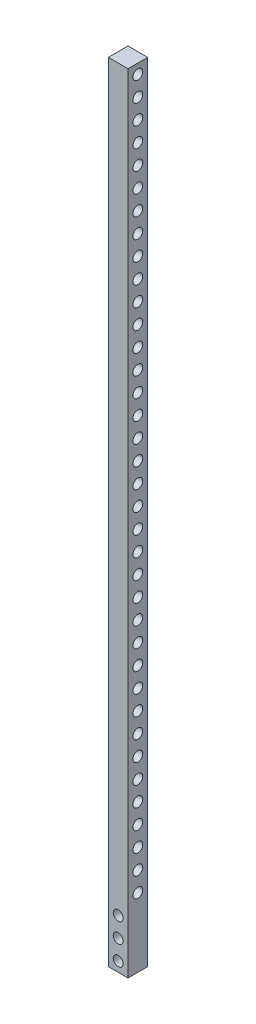
from build123d import *

# Parameters (mm, degrees)
ESQUISSE1_W             = 10
ESQUISSE1_H             = 400
ESQUISSE1_R             = 2.5
BASE_DEPTH              = 10
ESQUISSE2_R             = 2.5
ENL_V_MAT_EXTRU_1_DEPTH = 10


with BuildPart() as part:
    # Esquisse1 → BASE (new body)
    with BuildSketch(Plane(origin=(0, 0, 0), x_dir=(0, 0, -1), z_dir=(1, 0, 0))):
        Rectangle(ESQUISSE1_W, ESQUISSE1_H)
        with Locations((0, 195)):
            Circle(ESQUISSE1_R, mode=Mode.SUBTRACT)
        with Locations((0, 185)):
            Circle(ESQUISSE1_R, mode=Mode.SUBTRACT)
        with Locations((0, 175)):
            Circle(ESQUISSE1_R, mode=Mode.SUBTRACT)
        with Locations((0, 165)):
            Circle(ESQUISSE1_R, mode=Mode.SUBTRACT)
        with Locations((0, 155)):
            Circle(ESQUISSE1_R, mode=Mode.SUBTRACT)
        with Locations((0, 145)):
            Circle(ESQUISSE1_R, mode=Mode.SUBTRACT)
        with Locations((0, 135)):
            Circle(ESQUISSE1_R, mode=Mode.SUBTRACT)
        with Locations((0, 125)):
            Circle(ESQUISSE1_R, mode=Mode.SUBTRACT)
        with Locations((0, 115)):
            Circle(ESQUISSE1_R, mode=Mode.SUBTRACT)
        with Locations((0, 105)):
            Circle(ESQUISSE1_R, mode=Mode.SUBTRACT)
        with Locations((0, 95)):
            Circle(ESQUISSE1_R, mode=Mode.SUBTRACT)
        with Locations((0, 85)):
            Circle(ESQUISSE1_R, mode=Mode.SUBTRACT)
        with Locations((0, 75)):
            Circle(ESQUISSE1_R, mode=Mode.SUBTRACT)
        with Locations((0, 65)):
            Circle(ESQUISSE1_R, mode=Mode.SUBTRACT)
        with Locations((0, 55)):
            Circle(ESQUISSE1_R, mode=Mode.SUBTRACT)
        with Locations((0, 45)):
            Circle(ESQUISSE1_R, mode=Mode.SUBTRACT)
        with Locations((0, 35)):
            Circle(ESQUISSE1_R, mode=Mode.SUBTRACT)
        with Locations((0, 25)):
            Circle(ESQUISSE1_R, mode=Mode.SUBTRACT)
        with Locations((0, 15)):
            Circle(ESQUISSE1_R, mode=Mode.SUBTRACT)
        with Locations((0, 5)):
            Circle(ESQUISSE1_R, mode=Mode.SUBTRACT)
        with Locations((0, -5)):
            Circle(ESQUISSE1_R, mode=Mode.SUBTRACT)
        with Locations((0, -15)):
            Circle(ESQUISSE1_R, mode=Mode.SUBTRACT)
        with Locations((0, -25)):
            Circle(ESQUISSE1_R, mode=Mode.SUBTRACT)
        with Locations((0, -35)):
            Circle(ESQUISSE1_R, mode=Mode.SUBTRACT)
        with Locations((0, -45)):
            Circle(ESQUISSE1_R, mode=Mode.SUBTRACT)
        with Locations((0, -55)):
            Circle(ESQUISSE1_R, mode=Mode.SUBTRACT)
        with Locations((0, -65)):
            Circle(ESQUISSE1_R, mode=Mode.SUBTRACT)
        with Locations((0, -75)):
            Circle(ESQUISSE1_R, mode=Mode.SUBTRACT)
        with Locations((0, -85)):
            Circle(ESQUISSE1_R, mode=Mode.SUBTRACT)
        with Locations((0, -95)):
            Circle(ESQUISSE1_R, mode=Mode.SUBTRACT)
        with Locations((0, -105)):
            Circle(ESQUISSE1_R, mode=Mode.SUBTRACT)
        with Locations((0, -115)):
            Circle(ESQUISSE1_R, mode=Mode.SUBTRACT)
        with Locations((0, -125)):
            Circle(ESQUISSE1_R, mode=Mode.SUBTRACT)
        with Locations((0, -135)):
            Circle(ESQUISSE1_R, mode=Mode.SUBTRACT)
        with Locations((0, -145)):
            Circle(ESQUISSE1_R, mode=Mode.SUBTRACT)
        with Locations((0, -155)):
            Circle(ESQUISSE1_R, mode=Mode.SUBTRACT)
        with Locations((0, -165)):
            Circle(ESQUISSE1_R, mode=Mode.SUBTRACT)
    extrude(amount=BASE_DEPTH)

    # Esquisse2 → Enlèv. mat.-Extru.1 (cut)
    with BuildSketch(Plane.XY.offset(5)):
        with Locations((5, -195)):
            Circle(ESQUISSE2_R)
        with Locations((5, -185)):
            Circle(ESQUISSE2_R)
        with Locations((5, -175)):
            Circle(ESQUISSE2_R)
    extrude(amount=-ENL_V_MAT_EXTRU_1_DEPTH, mode=Mode.SUBTRACT)


solid = part.part
